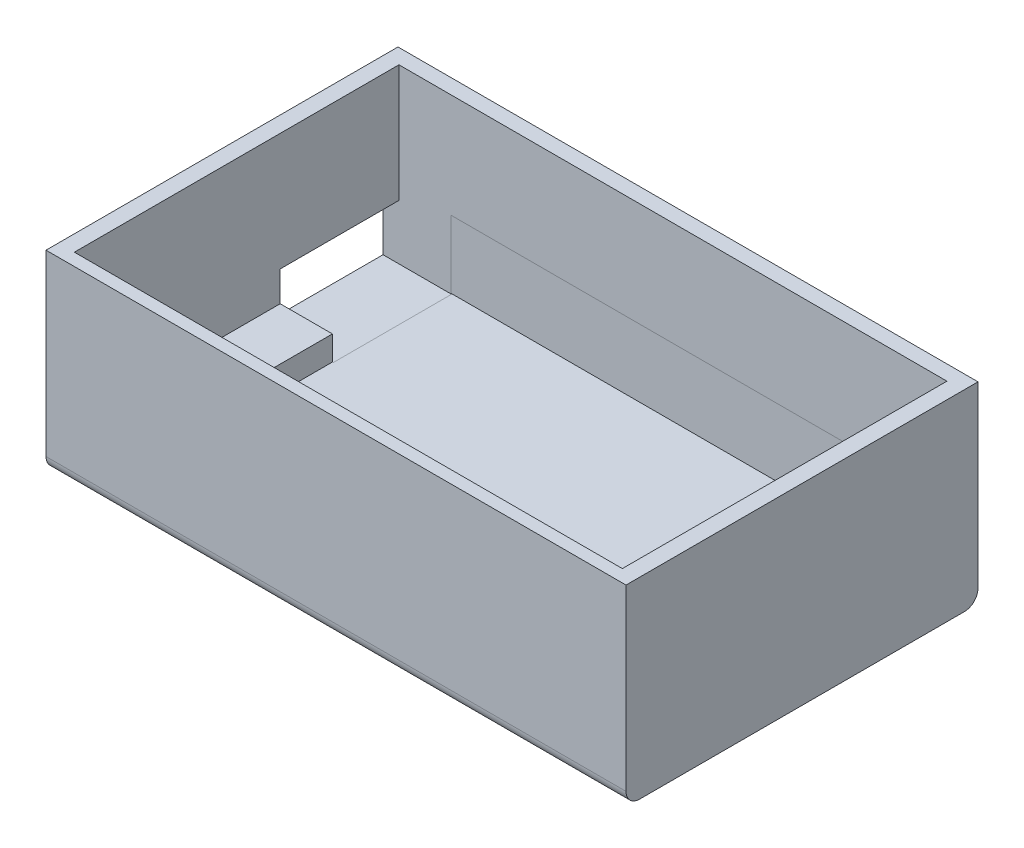
from build123d import *

# Parameters (mm, degrees)
SKETCH1_W           = 108.824103019
SKETCH1_H           = 66.04
BOSS_EXTRUDE4_DEPTH = 3.81
SKETCH5_W           = 108.824103019
SKETCH5_H           = 66.04
SKETCH5_W_2         = 93.0148
SKETCH5_H_2         = 60.9092
BOSS_EXTRUDE5_DEPTH = 12.7
SKETCH6_W           = 22.284444933
SKETCH6_H           = 10.320659342
CUT_EXTRUDE2_DEPTH  = 12.954
FILLET2_R           = 2.54
FILLET3_R           = 2.54
SKETCH8_W           = 9.964328511
SKETCH8_H           = 60.899089628
CUT_EXTRUDE4_DEPTH  = 8.128
SKETCH11_W          = 108.824103019
SKETCH11_H          = 66.04
SKETCH11_W_2        = 102.814143763
SKETCH11_H_2        = 60.899089628
BOSS_EXTRUDE6_DEPTH = 19.558


with BuildPart() as part:
    # Sketch1 → Boss-Extrude4 (new body)
    with BuildSketch(Plane(origin=(0, 0, 0), x_dir=(1, 0, 0), z_dir=(0, 1, 0))):
        with Locations((11.887002401, 13.227171797)):
            Rectangle(SKETCH1_W, SKETCH1_H)
    extrude(amount=BOSS_EXTRUDE4_DEPTH)

    # Sketch5 → Boss-Extrude5 (add)
    with BuildSketch(Plane(origin=(0, 3.81, 0), x_dir=(1, 0, 0), z_dir=(0, 1, 0))):
        with Locations((11.887002401, 13.227171797)):
            Rectangle(SKETCH5_W, SKETCH5_H)
        with Locations((16.771366144, 12.995675742)):
            Rectangle(SKETCH5_W_2, SKETCH5_H_2, mode=Mode.SUBTRACT)
    extrude(amount=BOSS_EXTRUDE5_DEPTH)

    # Sketch6 → Cut-Extrude2 (cut)
    with BuildSketch(Plane.ZY.offset(42.525049108)):
        with Locations((-32.297942904, 8.873970447)):
            Rectangle(SKETCH6_W, SKETCH6_H)
    extrude(amount=-CUT_EXTRUDE2_DEPTH, mode=Mode.SUBTRACT)

    # Fillet2
    fillet2_edges = [part.edges().sort_by_distance(p)[0] for p in [
        (11.887002402, 0, 19.792828203),
    ]]
    fillet(fillet2_edges, radius=FILLET2_R)

    # Fillet3
    fillet3_edges = [part.edges().sort_by_distance(p)[0] for p in [
        (11.887002402, 0, -46.247171797),
    ]]
    fillet(fillet3_edges, radius=FILLET3_R)

    # Sketch8 → Cut-Extrude4 (cut)
    with BuildSketch(Plane(origin=(0, 16.51, 0), x_dir=(1, 0, 0), z_dir=(0, 1, 0))):
        with Locations((-34.553213363, 12.990620556)):
            Rectangle(SKETCH8_W, SKETCH8_H)
    extrude(amount=-CUT_EXTRUDE4_DEPTH, mode=Mode.SUBTRACT)

    # Sketch11 → Boss-Extrude6 (add)
    with BuildSketch(Plane(origin=(0, 16.51, 0), x_dir=(1, 0, 0), z_dir=(0, 1, 0))):
        with Locations((11.887002401, 13.227171797)):
            Rectangle(SKETCH11_W, SKETCH11_H)
        with Locations((11.871694263, 12.990620556)):
            Rectangle(SKETCH11_W_2, SKETCH11_H_2, mode=Mode.SUBTRACT)
    extrude(amount=BOSS_EXTRUDE6_DEPTH)


solid = part.part
